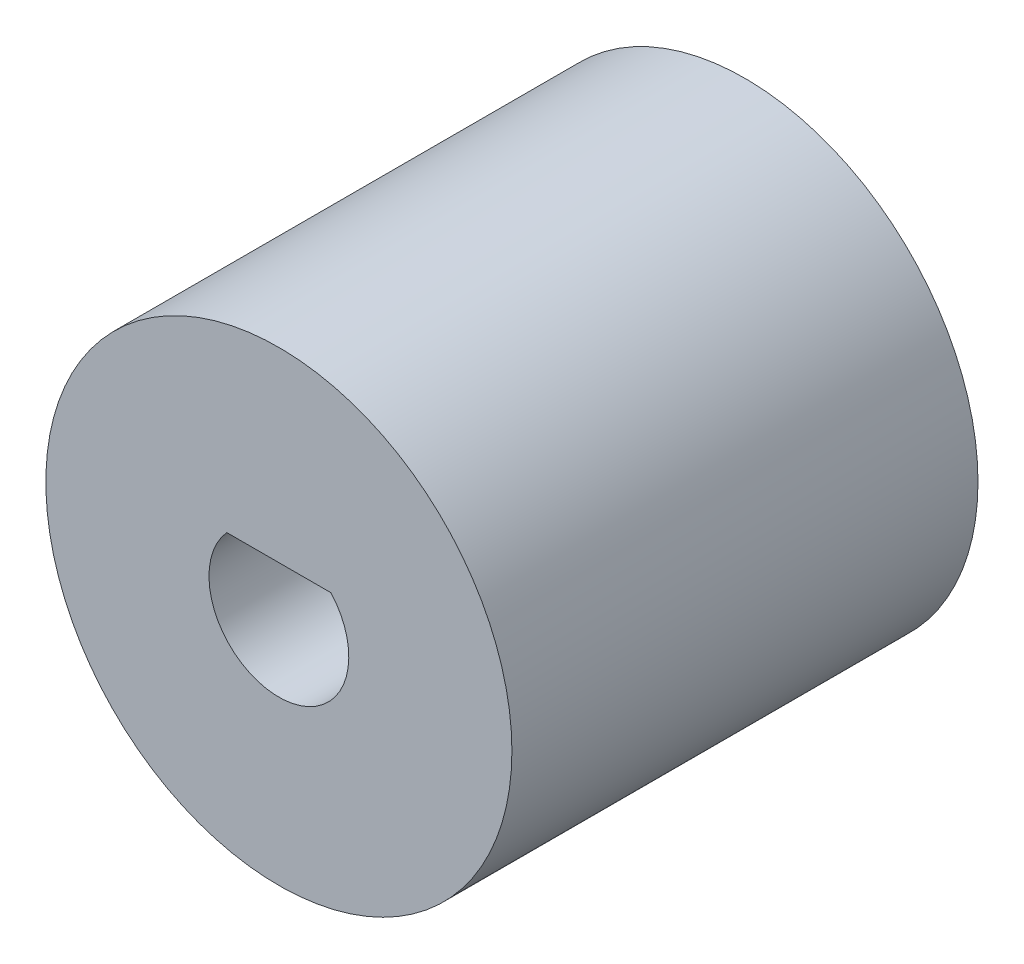
from build123d import *

# Parameters (mm, degrees)
SKETCH1_R           = 5
SKETCH1_R_2         = 2.400014974
BOSS_EXTRUDE1_DEPTH = 5
BOSS_EXTRUDE2_START = -5
SKETCH1_5_R         = 5
SKETCH1_5_R_2       = 2.400014974
BOSS_EXTRUDE2_DEPTH = 5


with BuildPart() as part:
    # Sketch1 → Boss-Extrude1 (new body)
    # profile 1 of 12: a face of its own
    with BuildSketch(Plane.XY):
        Circle(SKETCH1_R)
        Circle(SKETCH1_R_2, mode=Mode.SUBTRACT)
    # profile 2 of 12: a face of its own
    with BuildSketch(Plane.XY):
        with BuildLine():
            ThreePointArc((-0.799911499, -1.268913549), (-1.060590017, -1.060730322), (-1.268807724, -0.800079346))
            Line((-1.268807724, -0.800079346), (-2.262729528, -0.800079346))
            ThreePointArc((-2.262729528, -0.800079346), (-1.69700392, -1.697129804), (-0.799911499, -2.26278887))
            Line((-0.799911499, -2.26278887), (-0.799911499, -1.268913549))
        make_face()
    # profile 3 of 12: a face of its own
    with BuildSketch(Plane.XY):
        with BuildLine():
            ThreePointArc((0.800079346, -1.268807724), (9.9211e-05, -1.499999997), (-0.799911499, -1.268913549))
            Line((-0.799911499, -1.268913549), (-0.799911499, -2.26278887))
            ThreePointArc((-0.799911499, -2.26278887), (8.9014e-05, -2.400014973), (0.800079346, -2.262729528))
            Line((0.800079346, -2.262729528), (0.800079346, -1.268807724))
        make_face()
    # profile 4 of 12: a face of its own
    with BuildSketch(Plane.XY):
        with BuildLine():
            ThreePointArc((-1.268807724, -0.800079346), (-1.499999997, -9.9211e-05), (-1.268913549, 0.799911499))
            Line((-1.268913549, 0.799911499), (-2.26278887, 0.799911499))
            ThreePointArc((-2.26278887, 0.799911499), (-2.400014973, -8.9014e-05), (-2.262729528, -0.800079346))
            Line((-2.262729528, -0.800079346), (-1.268807724, -0.800079346))
        make_face()
    # profile 5 of 12: a face of its own
    with BuildSketch(Plane.XY):
        with BuildLine():
            ThreePointArc((-1.268913549, 0.799911499), (-1.197659588, 0.903112126), (-1.118033989, 1))
            ThreePointArc((-1.118033989, 1), (-0.96842867, 1.145489376), (-0.800079346, 1.268807724))
            Line((-0.800079346, 1.268807724), (-0.800079346, 2.262729528))
            ThreePointArc((-0.800079346, 2.262729528), (-1.697129804, 1.69700392), (-2.26278887, 0.799911499))
            Line((-2.26278887, 0.799911499), (-1.268913549, 0.799911499))
        make_face()
    # profile 6 of 12: a face of its own
    with BuildSketch(Plane.XY):
        with BuildLine():
            Line((-0.800079346, 2.262729528), (-0.800079346, 1.268807724))
            ThreePointArc((-0.800079346, 1.268807724), (-9.9211e-05, 1.499999997), (0.799911499, 1.268913549))
            Line((0.799911499, 1.268913549), (0.799911499, 2.26278887))
            ThreePointArc((0.799911499, 2.26278887), (-8.9014e-05, 2.400014973), (-0.800079346, 2.262729528))
        make_face()
    # profile 7 of 12: a face of its own
    with BuildSketch(Plane.XY):
        with BuildLine():
            Line((0.799911499, 2.26278887), (0.799911499, 1.268913549))
            ThreePointArc((0.799911499, 1.268913549), (0.968352905, 1.145553426), (1.118033989, 1))
            ThreePointArc((1.118033989, 1), (1.197599853, 0.903191338), (1.268807724, 0.800079346))
            Line((1.268807724, 0.800079346), (2.262729528, 0.800079346))
            ThreePointArc((2.262729528, 0.800079346), (1.69700392, 1.697129804), (0.799911499, 2.26278887))
        make_face()
    # profile 8 of 12: a face of its own
    with BuildSketch(Plane.XY):
        with BuildLine():
            Line((2.262729528, 0.800079346), (1.268807724, 0.800079346))
            ThreePointArc((1.268807724, 0.800079346), (1.4410433, 0.4164063), (1.5, 0))
            ThreePointArc((1.5, 0), (1.441070838, -0.416310988), (1.268913549, -0.799911499))
            Line((1.268913549, -0.799911499), (2.26278887, -0.799911499))
            ThreePointArc((2.26278887, -0.799911499), (2.365459685, -0.405798414), (2.400014974, 0))
            ThreePointArc((2.400014974, 0), (2.365444633, 0.405886146), (2.262729528, 0.800079346))
        make_face()
    # profile 9 of 12: a face of its own
    with BuildSketch(Plane.XY):
        with BuildLine():
            ThreePointArc((1.268913549, -0.799911499), (1.060730322, -1.060590017), (0.800079346, -1.268807724))
            Line((0.800079346, -1.268807724), (0.800079346, -2.262729528))
            ThreePointArc((0.800079346, -2.262729528), (1.697129804, -1.69700392), (2.26278887, -0.799911499))
            Line((2.26278887, -0.799911499), (1.268913549, -0.799911499))
        make_face()
    # profile 10 of 12: a face of its own
    with BuildSketch(Plane.XY):
        with BuildLine():
            Line((-0.800079346, 1.268807724), (-0.800079346, 1))
            Line((-0.800079346, 1), (0.799911499, 1))
            Line((0.799911499, 1), (0.799911499, 1.268913549))
            ThreePointArc((0.799911499, 1.268913549), (-9.9211e-05, 1.499999997), (-0.800079346, 1.268807724))
        make_face()
    # profile 11 of 12: a face of its own
    with BuildSketch(Plane.XY):
        with BuildLine():
            Line((0.799911499, 1.268913549), (0.799911499, 1))
            Line((0.799911499, 1), (1.118033989, 1))
            ThreePointArc((1.118033989, 1), (0.968352905, 1.145553426), (0.799911499, 1.268913549))
        make_face()
    # profile 12 of 12: a face of its own
    with BuildSketch(Plane.XY):
        with BuildLine():
            ThreePointArc((-0.800079346, 1.268807724), (-0.96842867, 1.145489376), (-1.118033989, 1))
            Line((-1.118033989, 1), (-0.800079346, 1))
            Line((-0.800079346, 1), (-0.800079346, 1.268807724))
        make_face()
    extrude(amount=BOSS_EXTRUDE1_DEPTH)

    # Sketch1<5> → Boss-Extrude2 (add)
    # profile 1 of 11: a face of its own
    with BuildSketch(Plane.XY.offset(BOSS_EXTRUDE2_START)):
        Circle(SKETCH1_5_R)
        Circle(SKETCH1_5_R_2, mode=Mode.SUBTRACT)
    # profile 2 of 11: a face of its own
    with BuildSketch(Plane.XY.offset(BOSS_EXTRUDE2_START)):
        with BuildLine():
            ThreePointArc((1.268913549, -0.799911499), (1.060730322, -1.060590017), (0.800079346, -1.268807724))
            Line((0.800079346, -1.268807724), (0.800079346, -2.262729528))
            ThreePointArc((0.800079346, -2.262729528), (1.697129804, -1.69700392), (2.26278887, -0.799911499))
            Line((2.26278887, -0.799911499), (1.268913549, -0.799911499))
        make_face()
    # profile 3 of 11: a face of its own
    with BuildSketch(Plane.XY.offset(BOSS_EXTRUDE2_START)):
        with BuildLine():
            Line((0.799911499, 2.26278887), (0.799911499, 1.268913549))
            ThreePointArc((0.799911499, 1.268913549), (0.968352905, 1.145553426), (1.118033989, 1))
            ThreePointArc((1.118033989, 1), (1.197599853, 0.903191338), (1.268807724, 0.800079346))
            Line((1.268807724, 0.800079346), (2.262729528, 0.800079346))
            ThreePointArc((2.262729528, 0.800079346), (1.69700392, 1.697129804), (0.799911499, 2.26278887))
        make_face()
    # profile 4 of 11: a face of its own
    with BuildSketch(Plane.XY.offset(BOSS_EXTRUDE2_START)):
        with BuildLine():
            ThreePointArc((-1.268913549, 0.799911499), (-1.197659588, 0.903112126), (-1.118033989, 1))
            ThreePointArc((-1.118033989, 1), (-0.96842867, 1.145489376), (-0.800079346, 1.268807724))
            Line((-0.800079346, 1.268807724), (-0.800079346, 2.262729528))
            ThreePointArc((-0.800079346, 2.262729528), (-1.697129804, 1.69700392), (-2.26278887, 0.799911499))
            Line((-2.26278887, 0.799911499), (-1.268913549, 0.799911499))
        make_face()
    # profile 5 of 11: a face of its own
    with BuildSketch(Plane.XY.offset(BOSS_EXTRUDE2_START)):
        with BuildLine():
            ThreePointArc((-0.799911499, -1.268913549), (-1.060590017, -1.060730322), (-1.268807724, -0.800079346))
            Line((-1.268807724, -0.800079346), (-2.262729528, -0.800079346))
            ThreePointArc((-2.262729528, -0.800079346), (-1.69700392, -1.697129804), (-0.799911499, -2.26278887))
            Line((-0.799911499, -2.26278887), (-0.799911499, -1.268913549))
        make_face()
    # profile 6 of 11: a face of its own
    with BuildSketch(Plane.XY.offset(BOSS_EXTRUDE2_START)):
        with BuildLine():
            Line((0.799911499, 1.268913549), (0.799911499, 1))
            Line((0.799911499, 1), (1.118033989, 1))
            ThreePointArc((1.118033989, 1), (0.968352905, 1.145553426), (0.799911499, 1.268913549))
        make_face()
    # profile 7 of 11: a face of its own
    with BuildSketch(Plane.XY.offset(BOSS_EXTRUDE2_START)):
        with BuildLine():
            ThreePointArc((-0.800079346, 1.268807724), (-0.96842867, 1.145489376), (-1.118033989, 1))
            Line((-1.118033989, 1), (-0.800079346, 1))
            Line((-0.800079346, 1), (-0.800079346, 1.268807724))
        make_face()
    # profile 8 of 11: a face of its own
    with BuildSketch(Plane.XY.offset(BOSS_EXTRUDE2_START)):
        with BuildLine():
            Line((-0.800079346, 1), (-1.118033989, 1))
            ThreePointArc((-1.118033989, 1), (-1.197659588, 0.903112126), (-1.268913549, 0.799911499))
            Line((-1.268913549, 0.799911499), (-0.800017929, 0.799911499))
            Line((-0.800017929, 0.799911499), (-0.800079346, 0.800017929))
            Line((-0.800079346, 0.800017929), (-0.800079346, 1))
        make_face()
    # profile 9 of 11: a face of its own
    with BuildSketch(Plane.XY.offset(BOSS_EXTRUDE2_START)):
        with BuildLine():
            Line((1.118033989, 1), (0.799911499, 1))
            Line((0.799911499, 1), (0.799911499, 0.800017929))
            Line((0.799911499, 0.800017929), (0.800017929, 0.800079346))
            Line((0.800017929, 0.800079346), (1.268807724, 0.800079346))
            ThreePointArc((1.268807724, 0.800079346), (1.197599853, 0.903191338), (1.118033989, 1))
        make_face()
    # profile 10 of 11: a face of its own
    with BuildSketch(Plane.XY.offset(BOSS_EXTRUDE2_START)):
        with BuildLine():
            Line((0.800079346, -0.800017929), (0.800079346, -1.268807724))
            ThreePointArc((0.800079346, -1.268807724), (1.060730322, -1.060590017), (1.268913549, -0.799911499))
            Line((1.268913549, -0.799911499), (0.800017929, -0.799911499))
            Line((0.800017929, -0.799911499), (0.800079346, -0.800017929))
        make_face()
    # profile 11 of 11: a face of its own
    with BuildSketch(Plane.XY.offset(BOSS_EXTRUDE2_START)):
        with BuildLine():
            Line((-0.800017929, -0.800079346), (-1.268807724, -0.800079346))
            ThreePointArc((-1.268807724, -0.800079346), (-1.060590017, -1.060730322), (-0.799911499, -1.268913549))
            Line((-0.799911499, -1.268913549), (-0.799911499, -0.800017929))
            Line((-0.799911499, -0.800017929), (-0.800017929, -0.800079346))
        make_face()
    extrude(amount=BOSS_EXTRUDE2_DEPTH)


solid = part.part
